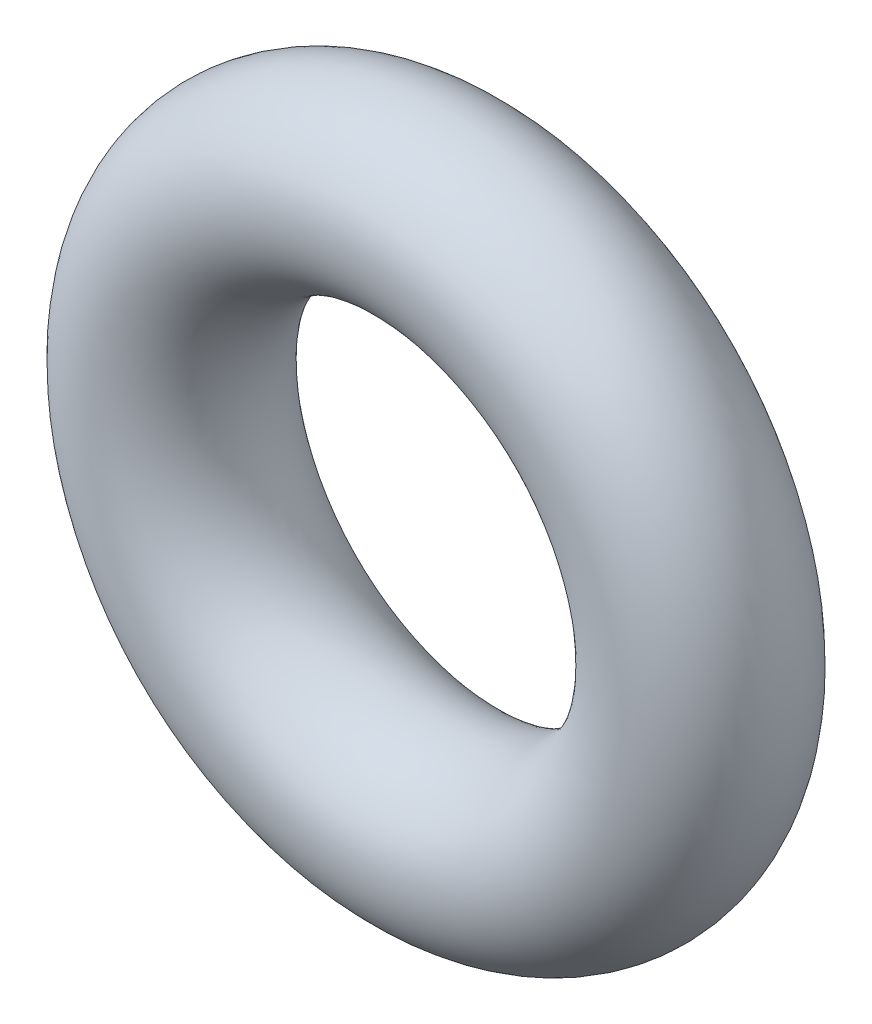
from build123d import *

# Parameters (mm, degrees)
SKETCH1_R = 2.5


with BuildPart() as part:
    # Sketch1 → Revolve1 (revolve)
    with BuildSketch(Plane(origin=(0, 0, 0), x_dir=(1, 0, 0), z_dir=(0, 1, 0))):
        with Locations((-7.5, 0)):
            Circle(SKETCH1_R)
    revolve(axis=Axis((0, 0, -5), (0, 0, 1)))


solid = part.part
